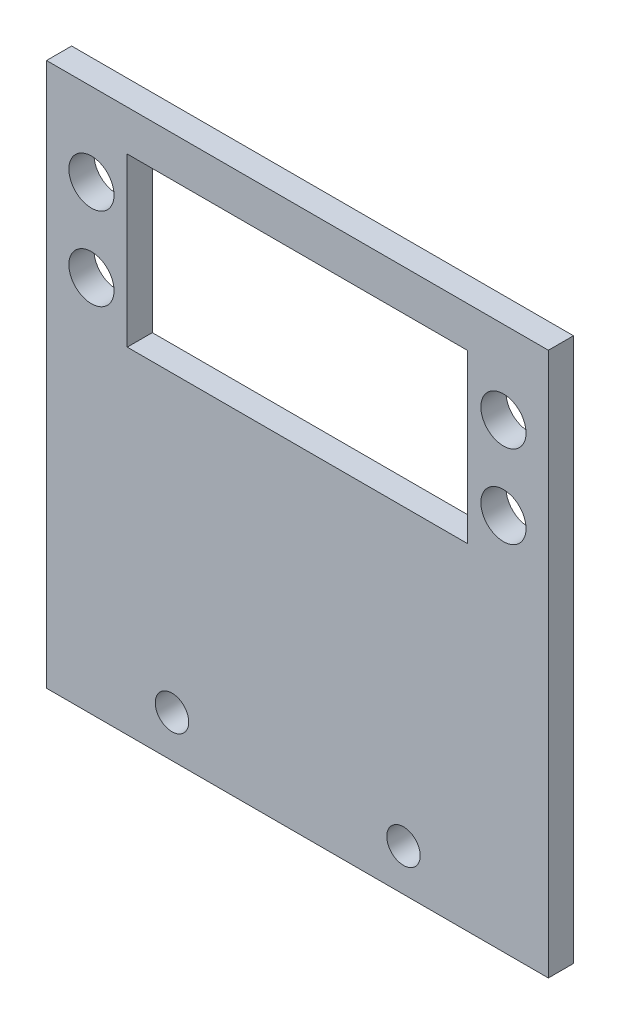
from build123d import *

# Parameters (mm, degrees)
SKETCH1_W           = 60
SKETCH1_H           = 65
SKETCH1_R           = 2.7
SKETCH1_R_2         = 2
SKETCH1_W_2         = 40.7
SKETCH1_H_2         = 20
BOSS_EXTRUDE1_DEPTH = 3


with BuildPart() as part:
    # Sketch1 → Boss-Extrude1 (new body)
    with BuildSketch(Plane.XY):
        with Locations((30, 32.5)):
            Rectangle(SKETCH1_W, SKETCH1_H)
        with Locations((5.370585291, 55.095272019)):
            Circle(SKETCH1_R, mode=Mode.SUBTRACT)
        with Locations((5.370585291, 45.195272019)):
            Circle(SKETCH1_R, mode=Mode.SUBTRACT)
        with Locations((54.63, 55.095272019)):
            Circle(SKETCH1_R, mode=Mode.SUBTRACT)
        with Locations((54.63, 45.195272019)):
            Circle(SKETCH1_R, mode=Mode.SUBTRACT)
        with Locations((15, 5)):
            Circle(SKETCH1_R_2, mode=Mode.SUBTRACT)
        with Locations((42.677171148, 5)):
            Circle(SKETCH1_R_2, mode=Mode.SUBTRACT)
        with Locations((30, 50.145272019)):
            Rectangle(SKETCH1_W_2, SKETCH1_H_2, mode=Mode.SUBTRACT)
    extrude(amount=BOSS_EXTRUDE1_DEPTH)


solid = part.part
